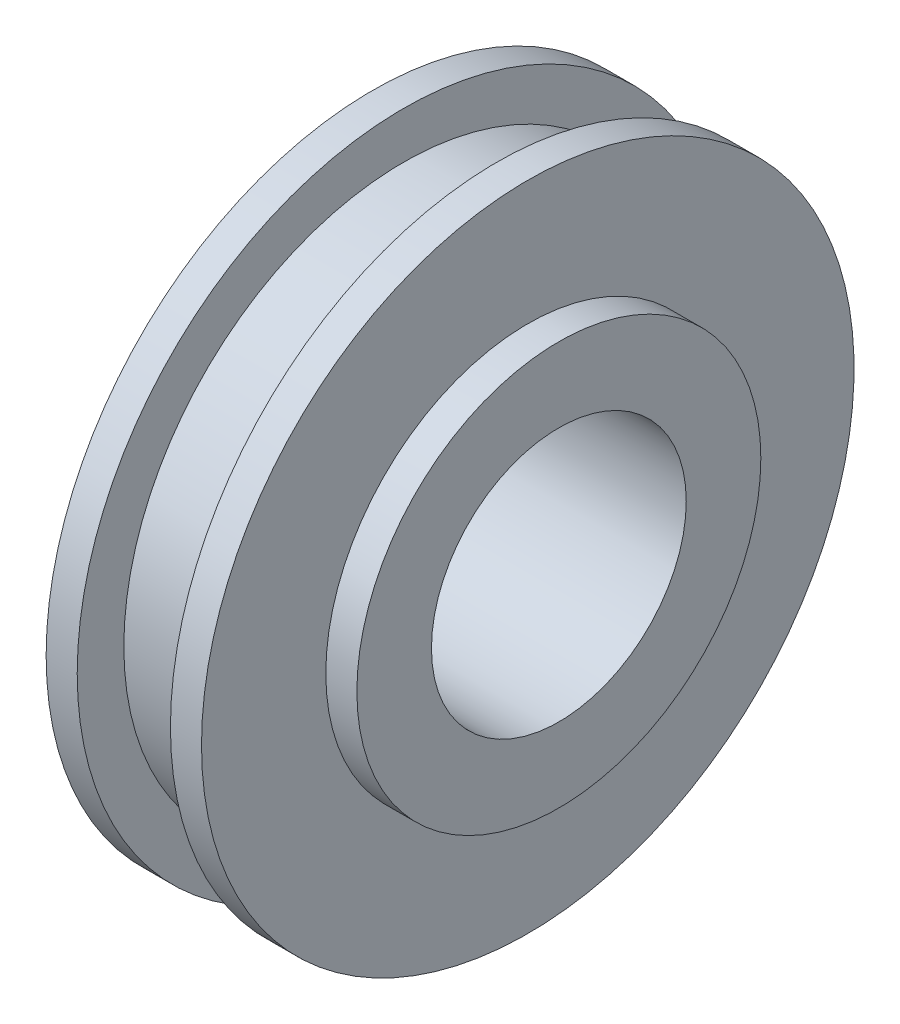
from build123d import *

# Parameters (mm, degrees)
SKETCH1_W           = 5
SKETCH1_H           = 6.4
SKETCH2_W           = 3
SKETCH2_H           = 1.5
SKETCH6_R           = 6.5
SKETCH6_R_2         = 4.1
BOSS_EXTRUDE1_DEPTH = 1
CUT_EXTRUDE2_DEPTH  = 1.5


with BuildPart() as part:
    # Sketch1 → Revolve1 (revolve)
    with BuildSketch(Plane.XY, mode=Mode.PRIVATE) as revolve1_sk:
        with Locations((-3, 7.3)):
            Rectangle(SKETCH1_W, SKETCH1_H)
    revolve(revolve1_sk.sketch.rotate(Axis((0, 0, 0), (1, 0, 0)), 90), axis=Axis((0, 0, 0), (1, 0, 0)))

    # Sketch2 → Cut-Revolve1 (revolve, cut)
    with BuildSketch(Plane.XY, mode=Mode.PRIVATE) as cut_revolve1_sk:
        with Locations((-3, 9.75)):
            Rectangle(SKETCH2_W, SKETCH2_H)
    revolve(cut_revolve1_sk.sketch.rotate(Axis((0, 0, 0), (1, 0, 0)), 90), axis=Axis((0, 0, 0), (1, 0, 0)), mode=Mode.SUBTRACT)

    # Sketch6 → Boss-Extrude1 (add)
    with BuildSketch(Plane(origin=(-0.5, 0, 0), x_dir=(0, 0, -1), z_dir=(1, 0, 0))):
        with Locations(Location((0, 0, 0), (0, 0, 180))):
            Circle(SKETCH6_R)
        with Locations(Location((0, 0, 0), (0, 0, 180))):
            Circle(SKETCH6_R_2, mode=Mode.SUBTRACT)
    extrude(amount=BOSS_EXTRUDE1_DEPTH)

    # Sketch5 → Cut-Extrude2 (cut)
    with BuildSketch(Plane.ZY.offset(5.5)):
        Polygon((-1.793384415, 8.175), (-0.9125, 8.175), (-0.9125, 5), (-1.482371795, 5), (-1.482371795, 7.645833333), (-2.133653846, 7.645833333), align=None)
        Polygon((0.186538462, 8.175), (2.221794872, 8.175), (2.221794872, 7.879251803), (0.821284054, 4.918589744), (0.316286058, 5.172996795), (1.486558494, 7.645833333), (0.186538462, 7.645833333), align=None)
        Polygon((-2.418589744, -5.679807692), (-2.110121194, -5.679807692), (-1.339903846, -7.369070513), (-0.569686498, -5.679807692), (-0.261217949, -5.679807692), (-1.319551282, -8), (-1.36025641, -8), align=None)
        with BuildLine():
            Line((0.430769231, -5.557692308), (0.145833333, -5.557692308))
            add(Edge.make_bspline(
                [(0.145833333, -5.557692308), (0.153552711, -5.525731412), (0.168643464, -5.463250474), (0.20011912, -5.37398103), (0.234408445, -5.289504693), (0.275582847, -5.211403254), (0.320494359, -5.138107107), (0.371949971, -5.071278687), (0.427575719, -5.009218354), (0.489102638, -4.954142774), (0.553626495, -4.90427012), (0.622056471, -4.861747746), (0.693015811, -4.825167979), (0.766996153, -4.795032483), (0.844217751, -4.772330758), (0.923982481, -4.755859941), (1.00649937, -4.745163716), (1.062513256, -4.74411981), (1.090955529, -4.743589744)],
                knots=[0, 0, 0, 0, 1.162005537, 2.271625781, 3.343758855, 4.383309926, 5.390229558, 6.379919256, 7.361854164, 8.333198761, 9.295911338, 10.242430842, 11.177959212, 12.116337295, 13.062827104, 14.020064771, 14.994644689, 16, 16, 16, 16], degree=3))
            add(Edge.make_bspline(
                [(1.090955529, -4.743589744), (1.132396302, -4.744840902), (1.214373905, -4.747315929), (1.334808955, -4.769916882), (1.450947569, -4.805681109), (1.56151853, -4.855096562), (1.664223822, -4.916045053), (1.755605934, -4.988584493), (1.834426226, -5.071315288), (1.90055184, -5.162694114), (1.952327018, -5.26035304), (1.990505371, -5.360864611), (2.013747896, -5.4639904), (2.016760115, -5.533620217), (2.018269231, -5.568504607)],
                knots=[0, 0, 0, 0, 1.083050992, 2.142477498, 3.193116406, 4.255571735, 5.30263384, 6.308962982, 7.297363603, 8.282367274, 9.249857812, 10.179914175, 11.08814088, 12, 12, 12, 12], degree=3))
            add(Edge.make_bspline(
                [(2.018269231, -5.568504607), (2.017213687, -5.602075057), (2.015148153, -5.667767217), (1.99760972, -5.763671718), (1.968094682, -5.854060884), (1.927209968, -5.939315224), (1.874285848, -6.018894186), (1.810175616, -6.092976815), (1.734426773, -6.161891694), (1.677023736, -6.201370073), (1.647470954, -6.221694712)],
                knots=[0, 0, 0, 0, 1.024540389, 2.004866551, 2.965041327, 3.920577974, 4.882998113, 5.874504559, 6.905732034, 8, 8, 8, 8], degree=3))
            add(Edge.make_bspline(
                [(1.647470954, -6.221694712), (1.681245474, -6.238003481), (1.748162567, -6.270315872), (1.839376261, -6.333685023), (1.922178334, -6.406851852), (1.968355279, -6.46394983), (1.99155649, -6.492638221)],
                knots=[0, 0, 0, 0, 1.015518401, 2.012035669, 3.001164323, 4, 4, 4, 4], degree=3))
            add(Edge.make_bspline(
                [(1.99155649, -6.492638221), (2.006833994, -6.513554896), (2.037138821, -6.55504572), (2.074545341, -6.621753764), (2.108480752, -6.689201186), (2.134924165, -6.75919579), (2.155401887, -6.83092631), (2.170039573, -6.904515912), (2.179132901, -6.980024689), (2.180435152, -7.031108153), (2.181089744, -7.056785857)],
                knots=[0, 0, 0, 0, 1.025084078, 2.033381695, 3.024893161, 4.013698104, 4.991890475, 5.976764909, 6.982997093, 8, 8, 8, 8], degree=3))
            add(Edge.make_bspline(
                [(2.181089744, -7.056785857), (2.179461863, -7.101244676), (2.176213764, -7.189953089), (2.147181497, -7.321012301), (2.1021752, -7.449124006), (2.038260694, -7.571656182), (1.960366596, -7.686301242), (1.867695309, -7.788877608), (1.761299782, -7.877050628), (1.642640372, -7.950719906), (1.514082691, -8.009609735), (1.376581975, -8.050483273), (1.232119426, -8.077104287), (1.133052806, -8.079958946), (1.0826873, -8.081410256)],
                knots=[0, 0, 0, 0, 0.955779014, 1.907060117, 2.875433937, 3.871313158, 4.872415639, 5.851225146, 6.836215519, 7.83643374, 8.849228613, 9.86973379, 10.916971861, 12, 12, 12, 12], degree=3))
            add(Edge.make_bspline(
                [(1.0826873, -8.081410256), (1.048742649, -8.080622663), (0.981950895, -8.079072942), (0.883758578, -8.068478782), (0.790031037, -8.04912942), (0.700641545, -8.023091422), (0.61551069, -7.990078913), (0.534898252, -7.94896838), (0.458308277, -7.900607231), (0.386463514, -7.844424619), (0.319372528, -7.781576547), (0.258818271, -7.710947302), (0.203791173, -7.633842514), (0.155764636, -7.549366599), (0.112551115, -7.458611259), (0.07700839, -7.360414407), (0.045725053, -7.255653901), (0.03118041, -7.182649094), (0.023717949, -7.145192308)],
                knots=[0, 0, 0, 0, 1.048658725, 2.063410685, 3.046034179, 4.001477787, 4.936774919, 5.862367409, 6.792675028, 7.730719943, 8.675894397, 9.627829632, 10.600096036, 11.597688215, 12.626045268, 13.701542398, 14.82072376, 16, 16, 16, 16], degree=3))
            Line((0.023717949, -7.145192308), (0.308653846, -7.145192308))
            add(Edge.make_bspline(
                [(0.308653846, -7.145192308), (0.316077261, -7.169638913), (0.330516446, -7.217189683), (0.355094845, -7.285624817), (0.383096778, -7.348361051), (0.413136413, -7.405858597), (0.444685432, -7.458683705), (0.479986828, -7.505439544), (0.516425981, -7.548179763), (0.543893681, -7.572259518), (0.557336739, -7.584044471)],
                knots=[0, 0, 0, 0, 1.198163088, 2.33053128, 3.407730985, 4.417276592, 5.372219308, 6.28897303, 7.162600585, 8, 8, 8, 8], degree=3))
            add(Edge.make_bspline(
                [(0.557336739, -7.584044471), (0.575113633, -7.597749888), (0.610612549, -7.625118417), (0.668459444, -7.660044894), (0.729296877, -7.69030811), (0.794443045, -7.713425463), (0.862492159, -7.732999484), (0.934544126, -7.745808812), (1.009963272, -7.754597367), (1.061459744, -7.755372912), (1.087775441, -7.755769231)],
                knots=[0, 0, 0, 0, 0.946170439, 1.889420265, 2.845303464, 3.807233317, 4.801018734, 5.828864929, 6.890507805, 8, 8, 8, 8], degree=3))
            add(Edge.make_bspline(
                [(1.087775441, -7.755769231), (1.117487547, -7.755210517), (1.175587005, -7.754118), (1.260363913, -7.744070751), (1.341015669, -7.729438162), (1.416646823, -7.706838528), (1.488248069, -7.678915898), (1.554815708, -7.643856273), (1.617223605, -7.602722133), (1.674672423, -7.555968753), (1.726330133, -7.504786397), (1.771813834, -7.451253111), (1.810480491, -7.395594608), (1.841671309, -7.337502884), (1.866300737, -7.277218498), (1.88306764, -7.214572274), (1.8947258, -7.150076897), (1.895675227, -7.106235618), (1.896153846, -7.084134615)],
                knots=[0, 0, 0, 0, 1.217147791, 2.380027433, 3.494444702, 4.572153297, 5.609568379, 6.639424714, 7.649109417, 8.668170816, 9.669597737, 10.625200337, 11.543417969, 12.441394052, 13.322311151, 14.205496177, 15.095365482, 16, 16, 16, 16], degree=3))
            add(Edge.make_bspline(
                [(1.896153846, -7.084134615), (1.894765644, -7.054551472), (1.891996147, -6.995532388), (1.870851936, -6.908702874), (1.836073109, -6.825043064), (1.787384474, -6.745980312), (1.728115634, -6.672705029), (1.658841755, -6.607325899), (1.578987576, -6.553378031), (1.505490981, -6.516104749), (1.440389731, -6.490671117), (1.384677204, -6.473730256), (1.322305142, -6.459385012), (1.254027812, -6.44603888), (1.179330751, -6.434680228), (1.098295282, -6.425208009), (1.010904984, -6.417628794), (0.95040657, -6.414244157), (0.919230769, -6.4125)],
                knots=[0, 0, 0, 0, 1.07054697, 2.135767047, 3.216561865, 4.33974944, 5.486079747, 6.621378074, 7.775625952, 8.963672916, 9.598146892, 10.304877434, 11.070270905, 11.915000392, 12.823868403, 13.805723172, 14.86925407, 16, 16, 16, 16], degree=3))
            Line((0.919230769, -6.4125), (0.919230769, -6.086858974))
            add(Edge.make_bspline(
                [(0.919230769, -6.086858974), (0.958511112, -6.086192402), (1.035451655, -6.084886752), (1.147841489, -6.069095199), (1.255313708, -6.04725063), (1.355486538, -6.013790491), (1.446789299, -5.974928222), (1.526000653, -5.929705146), (1.592010851, -5.879436052), (1.644499108, -5.823345042), (1.683986337, -5.76318782), (1.712857789, -5.700489138), (1.729912371, -5.634699454), (1.732188997, -5.58980072), (1.733333333, -5.567232572)],
                knots=[0, 0, 0, 0, 1.321986639, 2.589447074, 3.816329219, 5.01088745, 6.139805852, 7.153945165, 8.075214402, 8.924034688, 9.728124013, 10.488707548, 11.240355623, 12, 12, 12, 12], degree=3))
            add(Edge.make_bspline(
                [(1.733333333, -5.567232572), (1.732957403, -5.550652046), (1.732209509, -5.517665876), (1.722777692, -5.46947385), (1.708604455, -5.422755134), (1.689119272, -5.377708406), (1.663038735, -5.334646087), (1.63182759, -5.293201044), (1.59466367, -5.253609901), (1.552077443, -5.21670704), (1.506346735, -5.181537803), (1.456227296, -5.151680433), (1.403230309, -5.126148841), (1.347297101, -5.105094507), (1.288246156, -5.089256438), (1.226354921, -5.077884639), (1.16150538, -5.070774766), (1.117262451, -5.069751132), (1.094771635, -5.069230769)],
                knots=[0, 0, 0, 0, 0.884392785, 1.759457502, 2.611959086, 3.489218968, 4.37281399, 5.2945488, 6.255912374, 7.266815255, 8.301784654, 9.332968512, 10.37626691, 11.440494194, 12.520033166, 13.637162961, 14.798855837, 16, 16, 16, 16], degree=3))
            add(Edge.make_bspline(
                [(1.094771635, -5.069230769), (1.058620479, -5.070492933), (0.988008863, -5.072958233), (0.886213903, -5.094550967), (0.791581364, -5.129002514), (0.719247002, -5.170126039), (0.665832095, -5.210721075), (0.627662302, -5.246174383), (0.590178696, -5.285574159), (0.55584726, -5.331347113), (0.521127296, -5.380393416), (0.489518301, -5.435206327), (0.458802723, -5.494356028), (0.440294695, -5.536171353), (0.430769231, -5.557692308)],
                knots=[0, 0, 0, 0, 1.472543308, 2.876219568, 4.221790263, 5.565193594, 6.249813518, 6.953379497, 7.687249741, 8.463570142, 9.283606569, 10.136032583, 11.040678096, 12, 12, 12, 12], degree=3))
        make_face()
    extrude(amount=-CUT_EXTRUDE2_DEPTH, mode=Mode.SUBTRACT)


solid = part.part
